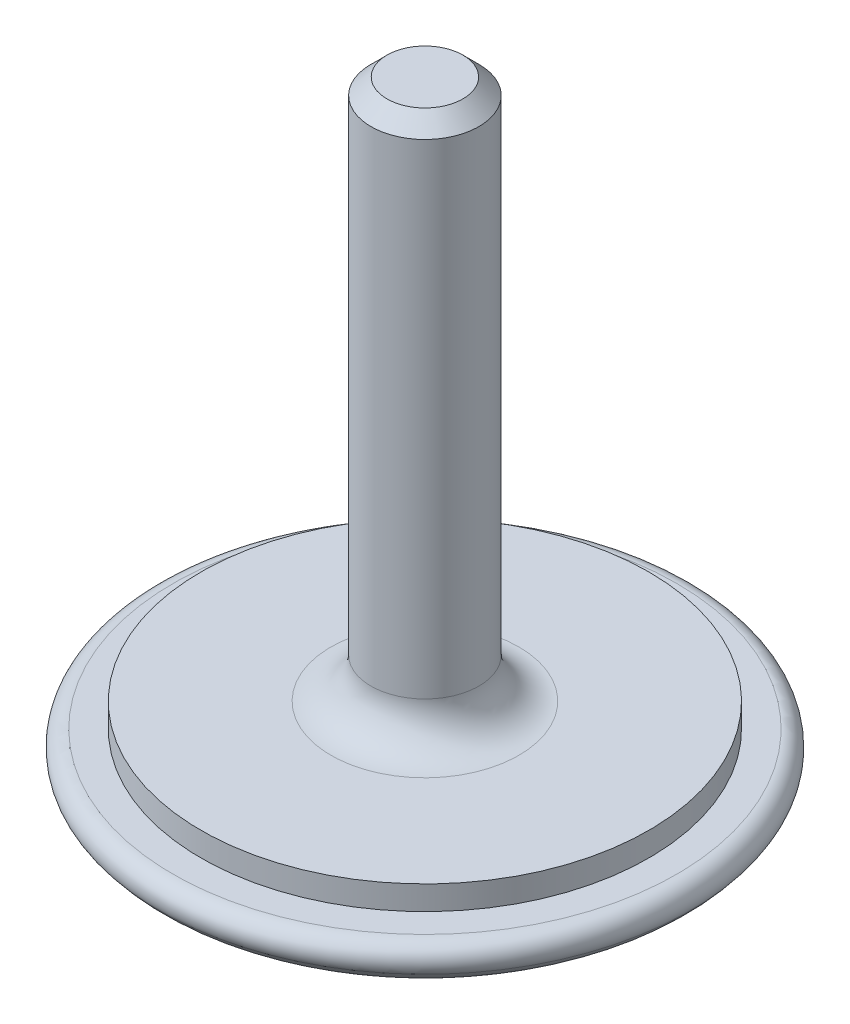
from build123d import *


with BuildPart() as part:
    # Sketch1 → Revolve1 (revolve)
    with BuildSketch(Plane.XY, mode=Mode.PRIVATE) as revolve1_sk:
        with BuildLine():
            Line((3, 0), (6.110643917, 0))
            ThreePointArc((6.110643917, 0), (7.242676055, 0.064281443), (8.36015446, 0.256299352))
            Line((8.36015446, 0.256299352), (14.800032714, 1.743062396))
            ThreePointArc((14.800032714, 1.743062396), (15.788233421, 2.169324212), (16.562410224, 2.916913705))
            ThreePointArc((16.562410224, 2.916913705), (16.639687107, 3.956570753), (15.75, 4.5))
            Line((15.75, 4.5), (14, 4.5))
            Line((14, 4.5), (14, 6))
            Line((14, 6), (5.875, 6))
            ThreePointArc((5.875, 6), (4.107233047, 6.732233047), (3.375, 8.5))
            Line((3.375, 8.5), (3.375, 38.8))
            Line((3.375, 38.8), (2.375, 39.8))
            Line((2.375, 39.8), (0, 39.8))
            Line((0, 39.8), (0, 1))
            ThreePointArc((0, 1), (1.58113883, 0.74341649), (3, 0))
        make_face()
    revolve(revolve1_sk.sketch.rotate(Axis((0, 0, 0), (0, 1, 0)), 90), axis=Axis((0, 0, 0), (0, 1, 0)))


solid = part.part
